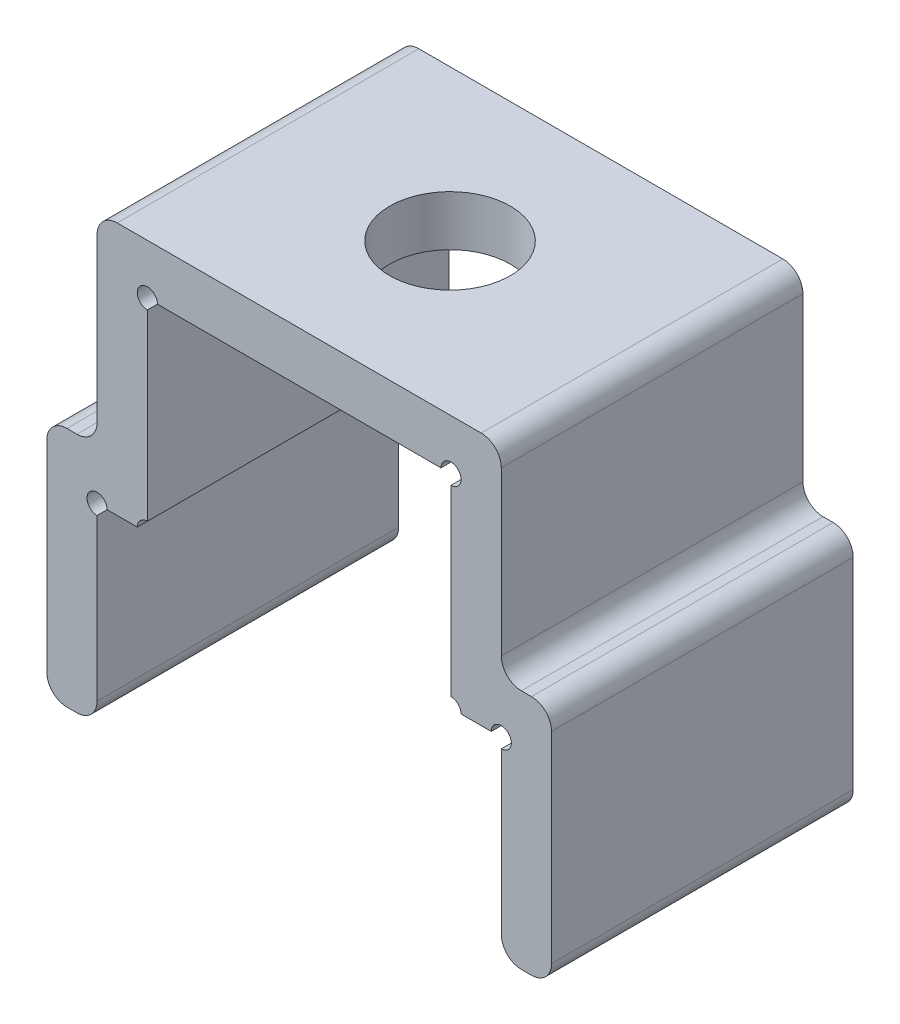
from build123d import *

# Parameters (mm, degrees)
SALIENTE_EXTRUIR1_DEPTH = 15
CROQUIS2_R              = 3
CORTAR_EXTRUIR1_DEPTH   = 20


with BuildPart() as part:
    # Croquis1 → Saliente-Extruir1 (new body)
    with BuildSketch(Plane.XY):
        with BuildLine():
            Line((-9.55, -5.05), (-8.05, -5.05))
            ThreePointArc((-8.05, -5.05), (-7.903553391, -4.696446609), (-7.55, -4.55))
            Line((-7.55, -4.55), (-7.55, 4.55))
            ThreePointArc((-7.55, 4.55), (-7.903553391, 5.403553391), (-7.05, 5.05))
            Line((-7.05, 5.05), (7.05, 5.05))
            ThreePointArc((7.05, 5.05), (7.903553391, 5.403553391), (7.55, 4.55))
            Line((7.55, 4.55), (7.55, -4.55))
            ThreePointArc((7.55, -4.55), (7.903553391, -4.696446609), (8.05, -5.05))
            Line((8.05, -5.05), (9.55, -5.05))
            ThreePointArc((9.55, -5.05), (10.403553391, -4.696446609), (10.05, -5.55))
            Line((10.05, -5.55), (10.05, -13.55))
            ThreePointArc((10.05, -13.55), (10.342893219, -14.257106781), (11.05, -14.55))
            Line((11.05, -14.55), (11.55, -14.55))
            ThreePointArc((11.55, -14.55), (12.257106781, -14.257106781), (12.55, -13.55))
            Line((12.55, -13.55), (12.55, -3.55))
            ThreePointArc((12.55, -3.55), (12.257106781, -2.842893219), (11.55, -2.55))
            Line((11.55, -2.55), (11.05, -2.55))
            ThreePointArc((11.05, -2.55), (10.342893219, -2.257106781), (10.05, -1.55))
            Line((10.05, -1.55), (10.05, 6.55))
            ThreePointArc((10.05, 6.55), (9.757106781, 7.257106781), (9.05, 7.55))
            Line((9.05, 7.55), (-9.05, 7.55))
            ThreePointArc((-9.05, 7.55), (-9.757106781, 7.257106781), (-10.05, 6.55))
            Line((-10.05, 6.55), (-10.05, -1.55))
            ThreePointArc((-10.05, -1.55), (-10.342893219, -2.257106781), (-11.05, -2.55))
            Line((-11.05, -2.55), (-11.55, -2.55))
            ThreePointArc((-11.55, -2.55), (-12.257106781, -2.842893219), (-12.55, -3.55))
            Line((-12.55, -3.55), (-12.55, -13.55))
            ThreePointArc((-12.55, -13.55), (-12.257106781, -14.257106781), (-11.55, -14.55))
            Line((-11.55, -14.55), (-11.05, -14.55))
            ThreePointArc((-11.05, -14.55), (-10.342893219, -14.257106781), (-10.05, -13.55))
            Line((-10.05, -13.55), (-10.05, -5.55))
            ThreePointArc((-10.05, -5.55), (-10.403553391, -4.696446609), (-9.55, -5.05))
        make_face()
    extrude(amount=SALIENTE_EXTRUIR1_DEPTH)

    # Croquis2 → Cortar-Extruir1 (cut)
    with BuildSketch(Plane(origin=(0, 7.55, 0), x_dir=(1, 0, 0), z_dir=(0, 1, 0))):
        with Locations(Location((0, -7.5, 0), (0, 0, 180))):
            Circle(CROQUIS2_R)
    extrude(amount=-CORTAR_EXTRUIR1_DEPTH, mode=Mode.SUBTRACT)


solid = part.part
